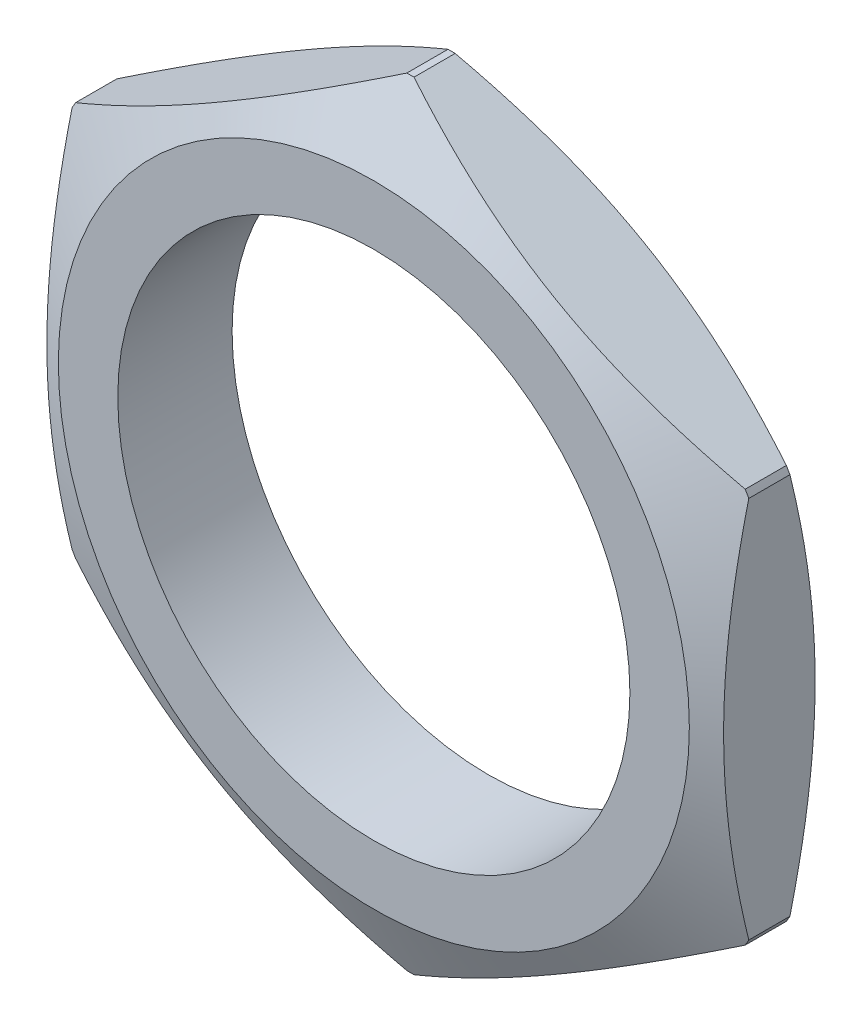
from build123d import *

# Parameters (mm, degrees)
SKETCH_3_R          = 8.5
SKETCH_3_R_2        = 5.6
EXTRUDE_2_DEPTH     = 2.5
CHAMFER_1_SIZE      = 0.8
CHAMFER_1_SIZE2     = 1.6
CHAMFER_2_SIZE      = 1.6
CHAMFER_2_SIZE2     = 0.8
SKETCH_4_OUTSIDE_W  = 23.834
SKETCH_4_OUTSIDE_H  = 23.834
CUT_EXTRUDE_3_DEPTH = 13.278029158


with BuildPart() as part:
    # Эскиз3 → Вытянуть2 (new body)
    with BuildSketch(Plane.XY):
        Circle(SKETCH_3_R)
        Circle(SKETCH_3_R_2, mode=Mode.SUBTRACT)
    extrude(amount=EXTRUDE_2_DEPTH)

    # Фаска1
    chamfer_1_edges = [part.edges().sort_by_distance(p)[0] for p in [
        (-8.5, 0, 2.5),
    ]]
    chamfer_1_side = [part.faces().sort_by_distance(p)[0] for p in [
        (-8.5, 0, 1.25),
    ]]
    chamfer(chamfer_1_edges, length=CHAMFER_1_SIZE, length2=CHAMFER_1_SIZE2, reference=chamfer_1_side[0])

    # Фаска2
    chamfer_2_edges = [part.edges().sort_by_distance(p)[0] for p in [
        (-8.5, 0, 0),
    ]]
    chamfer_2_side = [part.faces().sort_by_distance(p)[0] for p in [
        (-8.259583694, 0, 0),
    ]]
    chamfer(chamfer_2_edges, length=CHAMFER_2_SIZE, length2=CHAMFER_2_SIZE2, reference=chamfer_2_side[0])

    # Эскиз4 outside → Вытянуть3 (cut, through all)
    with BuildSketch(Plane.XY.offset(2.5)):
        Rectangle(SKETCH_4_OUTSIDE_W, SKETCH_4_OUTSIDE_H)
        Polygon((0, 8.544783984), (-7.4, 4.272391992), (-7.4, -4.272391992), (0, -8.544783984), (7.4, -4.272391992), (7.4, 4.272391992), align=None, mode=Mode.SUBTRACT)
    extrude(amount=-CUT_EXTRUDE_3_DEPTH, mode=Mode.SUBTRACT)


solid = part.part
